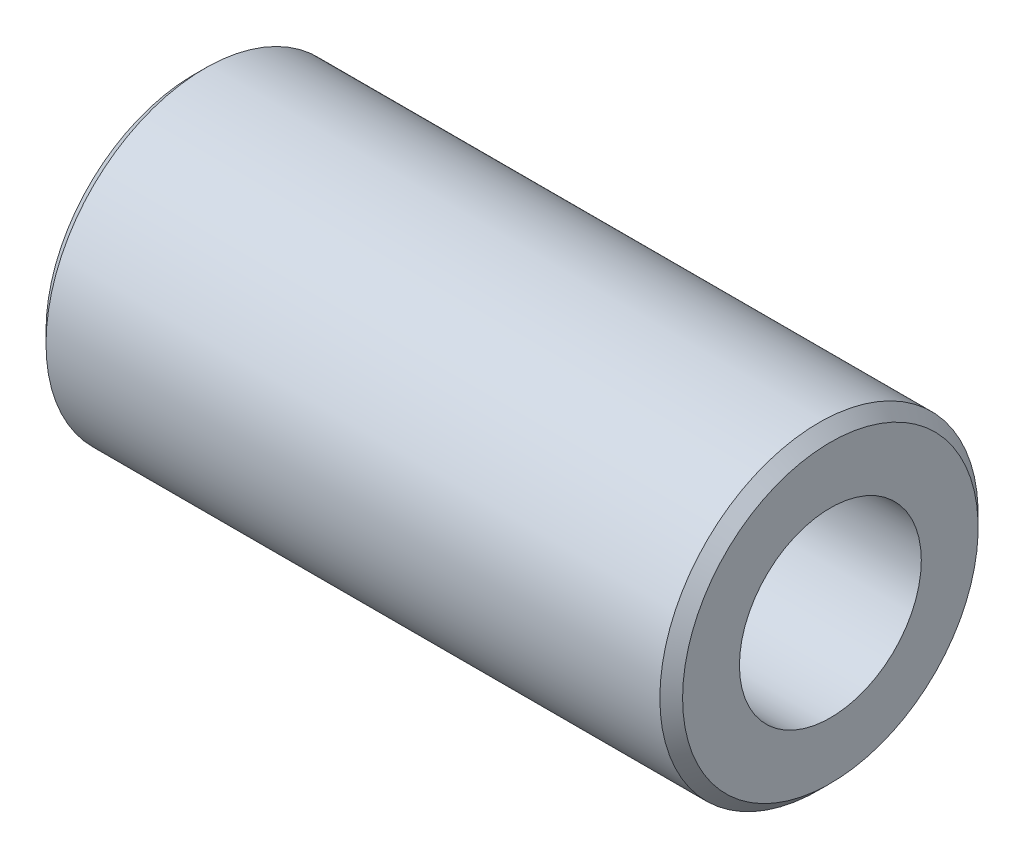
from build123d import *

# Parameters (mm, degrees)
SKETCH_1_W     = 28
SKETCH_1_H     = 3
CHAMFER_1_SIZE = 0.5


with BuildPart() as part:
    # 草图1 → 旋转1 (revolve)
    with BuildSketch(Plane.XY, mode=Mode.PRIVATE) as revolve_1_sk:
        with Locations((0, 5.5)):
            Rectangle(SKETCH_1_W, SKETCH_1_H)
    revolve(revolve_1_sk.sketch.rotate(Axis((18.125613416, 0, 0), (-1, 0, 0)), 90), axis=Axis((18.125613416, 0, 0), (-1, 0, 0)))

    # 倒角1
    chamfer_1_edges = [part.edges().sort_by_distance(p)[0] for p in [
        (-14, 0, 7),
        (14, 0, 7),
    ]]
    chamfer(chamfer_1_edges, length=CHAMFER_1_SIZE)


solid = part.part
